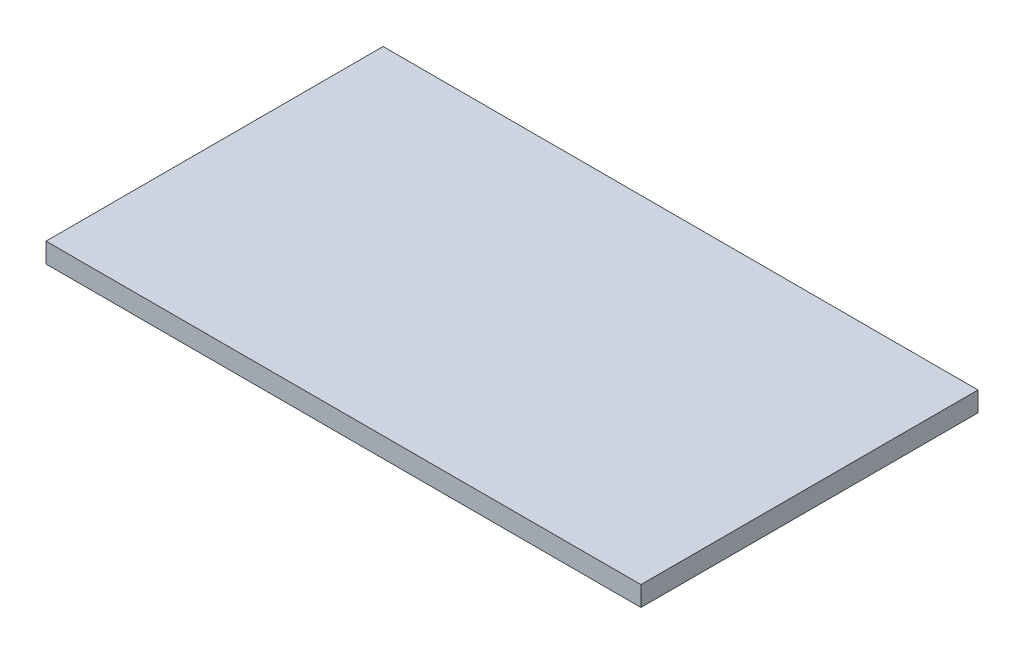
from build123d import *

# Parameters (mm, degrees)
SKETCH1_W           = 300
SKETCH1_H           = 170
BOSS_EXTRUDE1_DEPTH = 10


with BuildPart() as part:
    # Sketch1 → Boss-Extrude1 (new body)
    with BuildSketch(Plane(origin=(0, 0, 0), x_dir=(1, 0, 0), z_dir=(0, 1, 0))):
        Rectangle(SKETCH1_W, SKETCH1_H)
    extrude(amount=BOSS_EXTRUDE1_DEPTH)


solid = part.part
